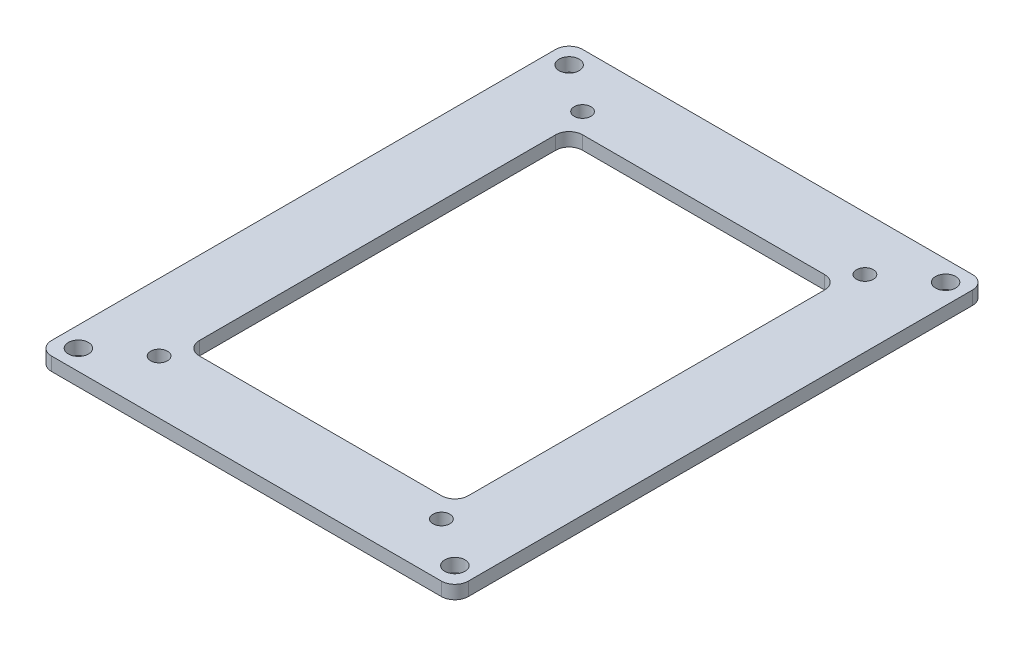
from build123d import *

# Parameters (mm, degrees)
SKETCH_1_W          = 62
SKETCH_1_H          = 79
SKETCH_1_R          = 1.25
EXTRUDE_1_DEPTH     = 2
SKETCH_2_R          = 1.498589197
CUT_EXTRUDE_1_DEPTH = 2
SKETCH_3_W          = 40
SKETCH_3_H          = 57
CUT_EXTRUDE_2_DEPTH = 2
FILLET_1_R          = 2


with BuildPart() as part:
    # 草图1 → 凸台-拉伸1 (new body)
    with BuildSketch(Plane(origin=(0, 0, 0), x_dir=(1, 0, 0), z_dir=(0, 1, 0))):
        Rectangle(SKETCH_1_W, SKETCH_1_H)
        with Locations(Location((-21, 31.5, 0), (0, 0, 270))):
            Circle(SKETCH_1_R, mode=Mode.SUBTRACT)
        with Locations(Location((21, 31.5, 0), (0, 0, 270))):
            Circle(SKETCH_1_R, mode=Mode.SUBTRACT)
        with Locations(Location((-21, -31.5, 0), (0, 0, 270))):
            Circle(SKETCH_1_R, mode=Mode.SUBTRACT)
        with Locations(Location((21, -31.5, 0), (0, 0, 270))):
            Circle(SKETCH_1_R, mode=Mode.SUBTRACT)
    extrude(amount=EXTRUDE_1_DEPTH)

    # 草图2 → 切除-拉伸1 (cut)
    with BuildSketch(Plane(origin=(0, 2, 0), x_dir=(1, 0, 0), z_dir=(0, 1, 0))):
        with Locations(Location((28, 36.5, 0), (0, 0, 270))):
            Circle(SKETCH_2_R)
        with Locations(Location((-28, 36.5, 0), (0, 0, 270))):
            Circle(SKETCH_2_R)
        with Locations(Location((-28, -36.5, 0), (0, 0, 270))):
            Circle(SKETCH_2_R)
        with Locations(Location((28, -36.5, 0), (0, 0, 270))):
            Circle(SKETCH_2_R)
    extrude(amount=-CUT_EXTRUDE_1_DEPTH, mode=Mode.SUBTRACT)

    # 草图3 → 切除-拉伸2 (cut)
    with BuildSketch(Plane(origin=(0, 2, 0), x_dir=(1, 0, 0), z_dir=(0, 1, 0))):
        Rectangle(SKETCH_3_W, SKETCH_3_H)
    extrude(amount=-CUT_EXTRUDE_2_DEPTH, mode=Mode.SUBTRACT)

    # 圆角1
    fillet_1_edges = [part.edges().sort_by_distance(p)[0] for p in [
        (20, 1, -28.5),
        (20, 1, 28.5),
        (-20, 1, 28.5),
        (-20, 1, -28.5),
        (31, 1, 39.5),
        (-31, 1, 39.5),
        (-31, 1, -39.5),
        (31, 1, -39.5),
    ]]
    fillet(fillet_1_edges, radius=FILLET_1_R)


solid = part.part
